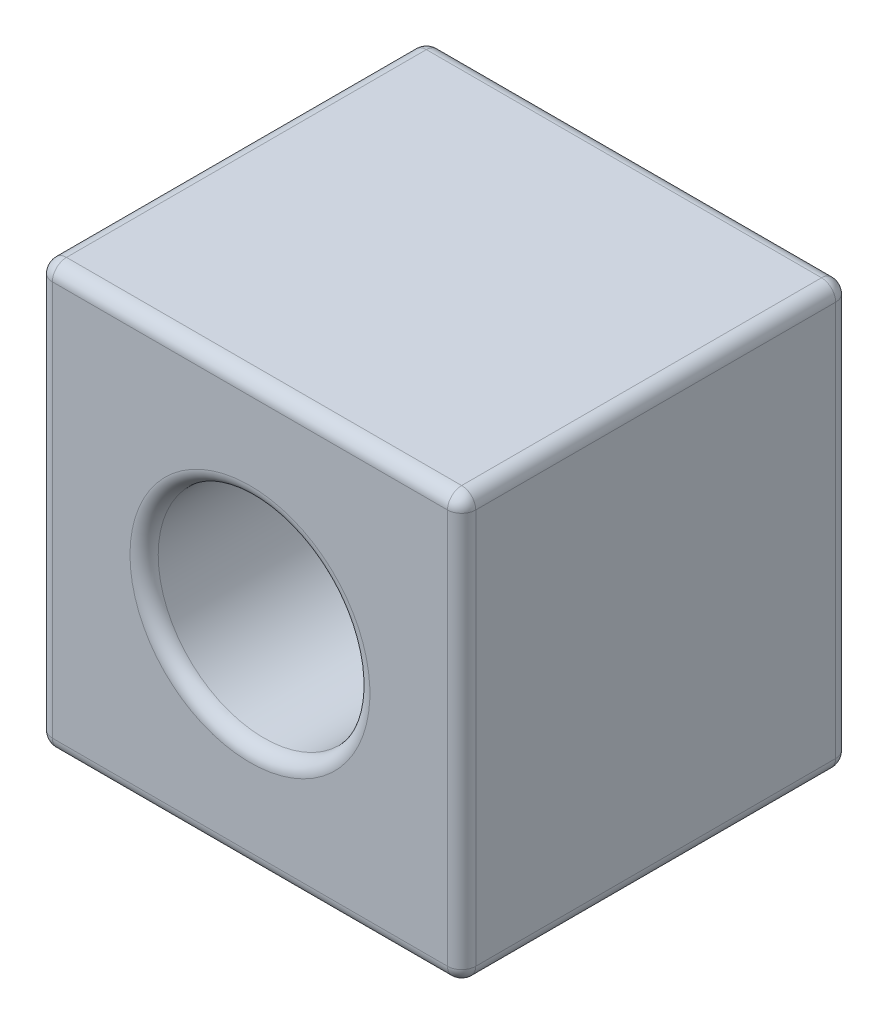
from build123d import *

# Parameters (mm, degrees)
ESQUISSE1_R      = 1.5
EXTRUSION1_DEPTH = 5.5
CONG_1_R         = 0.2


with BuildPart() as part:
    # Esquisse1 → Extrusion1 (new body)
    with BuildSketch(Plane.XY):
        with BuildLine():
            Line((-2.8, 3), (2.8, 3))
            ThreePointArc((2.8, 3), (2.941421356, 2.941421356), (3, 2.8))
            Line((3, 2.8), (3, -2.8))
            ThreePointArc((3, -2.8), (2.941421356, -2.941421356), (2.8, -3))
            Line((2.8, -3), (-2.8, -3))
            ThreePointArc((-2.8, -3), (-2.941421356, -2.941421356), (-3, -2.8))
            Line((-3, -2.8), (-3, 2.8))
            ThreePointArc((-3, 2.8), (-2.941421356, 2.941421356), (-2.8, 3))
        make_face()
        with Locations(Location((0, 0, 0), (0, 0, 180))):
            Circle(ESQUISSE1_R, mode=Mode.SUBTRACT)
    extrude(amount=EXTRUSION1_DEPTH)

    # Congé1
    cong_1_edges = [part.edges().sort_by_distance(p)[0] for p in [
        (0, 3, 0),
        (0, 3, 5.5),
        (2.941421356, 2.941421356, 0),
        (2.941421356, 2.941421356, 5.5),
        (3, 0, 0),
        (3, 0, 5.5),
        (2.941421356, -2.941421356, 0),
        (2.941421356, -2.941421356, 5.5),
        (0, -3, 0),
        (0, -3, 5.5),
        (-2.941421356, -2.941421356, 0),
        (-2.941421356, -2.941421356, 5.5),
        (-3, 0, 0),
        (-3, 0, 5.5),
        (-2.941421356, 2.941421356, 0),
        (-2.941421356, 2.941421356, 5.5),
        (1.5, 0, 0),
        (1.5, 0, 5.5),
    ]]
    fillet(cong_1_edges, radius=CONG_1_R)


solid = part.part
